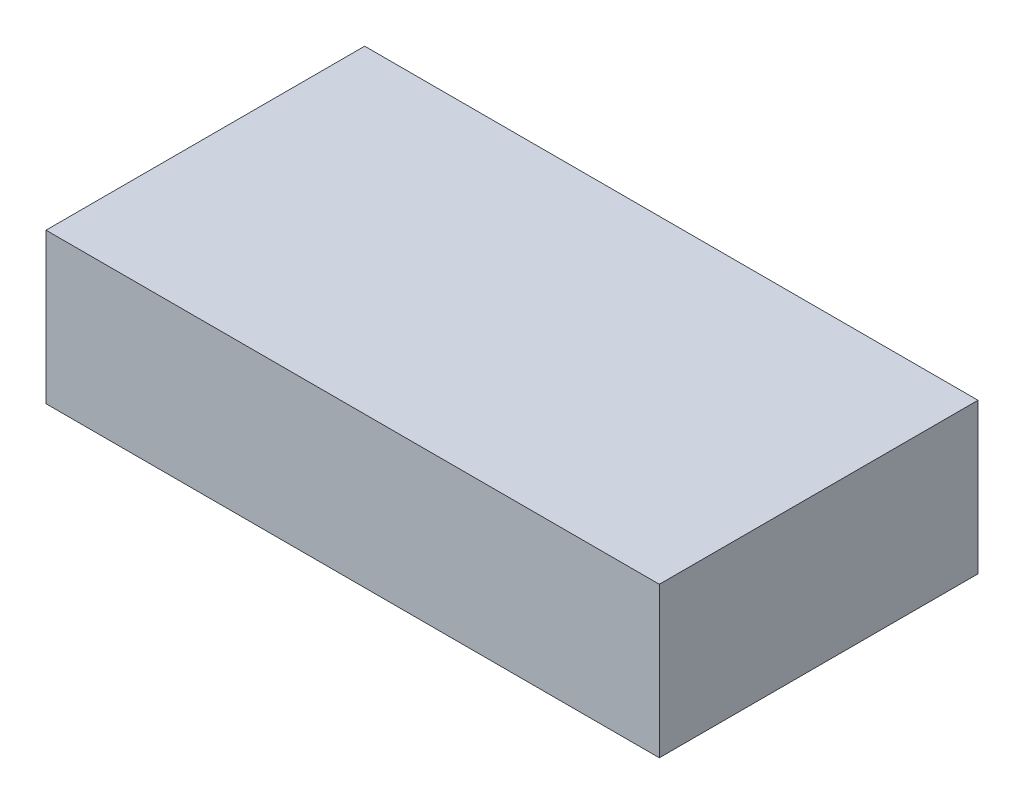
from build123d import *

# Parameters (mm, degrees)
SKETCH1_W           = 102
SKETCH1_H           = 53
BOSS_EXTRUDE1_DEPTH = 25


with BuildPart() as part:
    # Sketch1 → Boss-Extrude1 (new body)
    with BuildSketch(Plane(origin=(0, 0, 0), x_dir=(1, 0, 0), z_dir=(0, 1, 0))):
        Rectangle(SKETCH1_W, SKETCH1_H)
    extrude(amount=BOSS_EXTRUDE1_DEPTH)


solid = part.part
